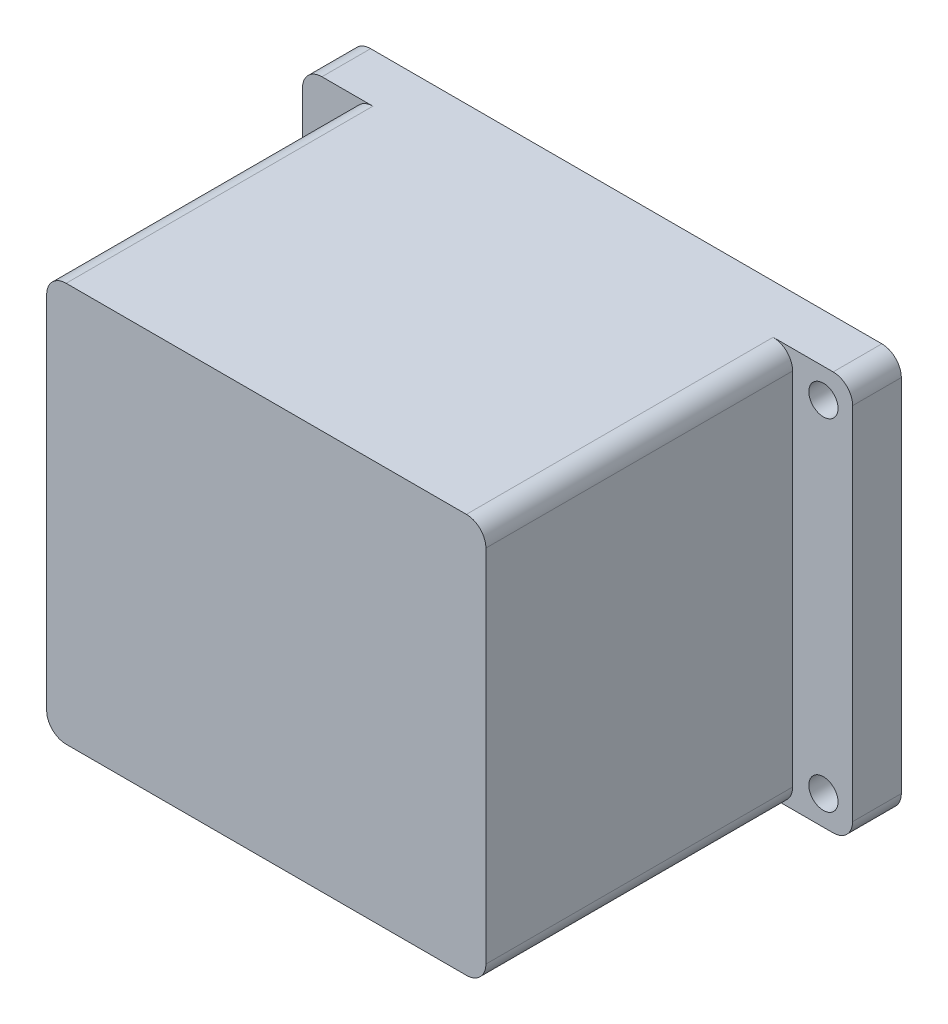
from build123d import *

# Parameters (mm, degrees)
SKETCH_1_W      = 56.5
SKETCH_1_H      = 41
SKETCH_1_R      = 1.5
EXTRUDE_1_DEPTH = 5
FILLET_1_R      = 2
SKETCH_2_W      = 45.103373127
SKETCH_2_H      = 41
EXTRUDE_2_DEPTH = 31.5
FILLET_2_R      = 2


with BuildPart() as part:
    # 草图1 → 凸台-拉伸1 (new body)
    with BuildSketch(Plane.XY):
        with Locations((28.25, 20.5)):
            Rectangle(SKETCH_1_W, SKETCH_1_H)
        with Locations((2.8, 20.5)):
            Circle(SKETCH_1_R, mode=Mode.SUBTRACT)
        with Locations((53.5, 38)):
            Circle(SKETCH_1_R, mode=Mode.SUBTRACT)
        with Locations((53.5, 3)):
            Circle(SKETCH_1_R, mode=Mode.SUBTRACT)
    extrude(amount=EXTRUDE_1_DEPTH)

    # 圆角1
    fillet_1_edges = [part.edges().sort_by_distance(p)[0] for p in [
        (0, 41, 2.5),
        (56.5, 41, 2.5),
        (56.5, 0, 2.5),
        (0, 0, 2.5),
    ]]
    fillet(fillet_1_edges, radius=FILLET_1_R)

    # 草图2 → 凸台-拉伸2 (add)
    with BuildSketch(Plane.XY.offset(5)):
        with Locations((27.783569507, 20.5)):
            Rectangle(SKETCH_2_W, SKETCH_2_H)
    extrude(amount=EXTRUDE_2_DEPTH)

    # 圆角2
    fillet_2_edges = [part.edges().sort_by_distance(p)[0] for p in [
        (50.33525607, 0, 20.75),
        (50.33525607, 41, 20.75),
        (5.231882943, 41, 20.75),
        (5.231882943, 0, 20.75),
    ]]
    fillet(fillet_2_edges, radius=FILLET_2_R)


solid = part.part
